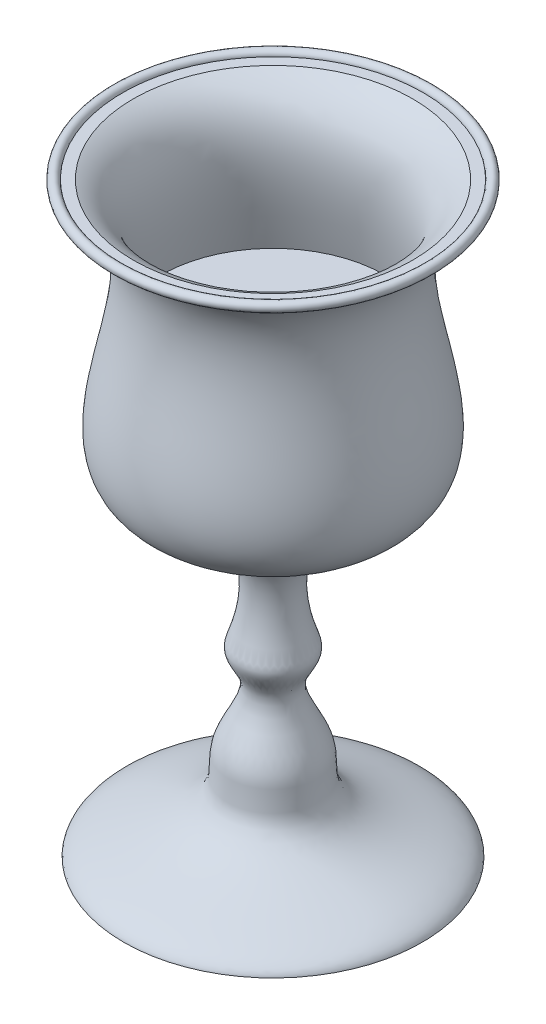
from build123d import *

# Parameters (mm, degrees)
SKETCH2_R = 1.325770192


with BuildPart() as part:
    # Sketch1 → Revolve1 (revolve)
    with BuildSketch(Plane.XY):
        with BuildLine():
            Line((0, 0), (40.940243325, 0))
            add(Edge.make_bspline(
                [(40.940243325, 0), (39.591971384, 5.604006032), (9.920963873, 8.097379369), (13.721820557, 29.491774751), (3.343659872, 39.338946132), (8.507081828, 46.532516314), (9.837574634, 49.764689361), (6.325714634, 58.849794746), (4.013119803, 80.549648054), (60.153402278, 89.18179733), (15.587631197, 145.54058315), (42.582083051, 160.825931112)],
                knots=[0, 0, 0, 0, 0.173163406, 0.216359068, 0.311104435, 0.331402797, 0.34758286, 0.362383879, 0.478386764, 0.619445941, 1, 1, 1, 1], degree=3))
            Line((42.582083051, 160.825931112), (38.349093822, 160.825931112))
            add(Edge.make_bspline(
                [(0, 80.412965556), (21.888121574, 84.736018247), (48.768067019, 95.20054366), (16.489910143, 150.451024937), (38.349093822, 160.825931112)],
                knots=[0, 0, 0, 0, 0.287216709, 1, 1, 1, 1], degree=3))
            Line((0, 80.412965556), (0, 0))
        make_face()
    revolve(axis=Axis((0, 0, 0), (0, 1, 0)))

    # Sketch2 → Revolve2 (revolve)
    with BuildSketch(Plane.XY, mode=Mode.PRIVATE) as revolve2_sk:
        with Locations((42.582083051, 160.825931112)):
            Circle(SKETCH2_R)
    revolve(revolve2_sk.sketch.rotate(Axis((0, 114.193365513, 0), (0, 1, 0)), 90), axis=Axis((0, 114.193365513, 0), (0, 1, 0)))


with BuildPart() as body_2:
    # Sketch6 → Revolve3 (revolve)
    with BuildSketch(Plane.XY, mode=Mode.PRIVATE) as revolve3_sk:
        with BuildLine():
            Line((0, 80.501238784), (0, 122.672950951))
            Line((0, 122.672950951), (30.820348629, 122.672950951))
            add(Edge.make_bspline(
                [(0, 80.501238784), (20.709593791, 84.66235695), (37.298310021, 90.839042275), (32.989544465, 111.741335174), (30.820348629, 122.672950951)],
                knots=[0.006861794, 0.006861794, 0.006861794, 0.006861794, 0.287216709, 0.580272355, 0.580272355, 0.580272355, 0.580272355], degree=3))
        make_face()
    revolve(revolve3_sk.sketch.rotate(Axis((0, 80.501238784, 0), (0, 1, 0)), 90), axis=Axis((0, 80.501238784, 0), (0, 1, 0)))


solid = Compound([part.part, body_2.part])
